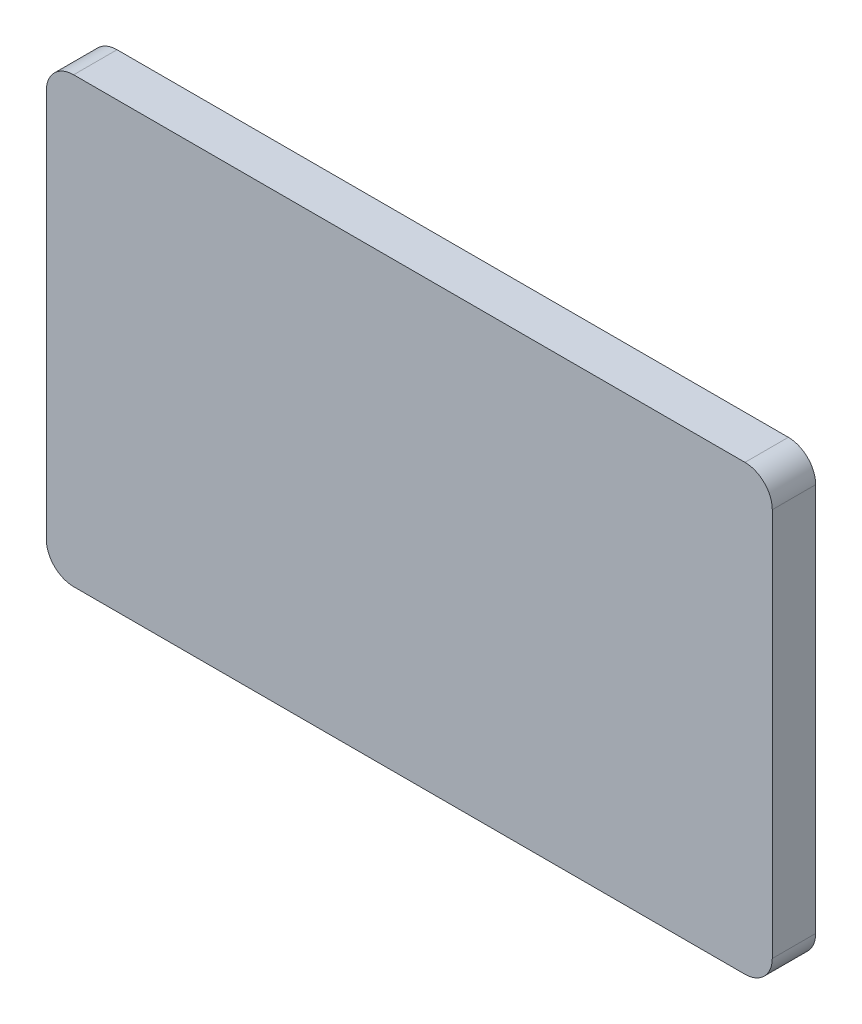
from build123d import *

# Parameters (mm, degrees)
BOSS_EXTRUDE1_START = 0.5
BOSS_EXTRUDE1_DEPTH = 1.5875


with BuildPart() as part:
    # Sketch1 → Boss-Extrude1 (new body)
    with BuildSketch(Plane.XY.offset(6.134999756).offset(BOSS_EXTRUDE1_START)):
        with BuildLine():
            Line((-3.565294436, 51.676898136), (-28.125294436, 51.676898136))
            ThreePointArc((-28.125294436, 51.676898136), (-28.832401217, 51.384004917), (-29.125294436, 50.676898136))
            Line((-29.125294436, 50.676898136), (-29.125294436, 36.456898136))
            ThreePointArc((-29.125294436, 36.456898136), (-28.832401217, 35.749791355), (-28.125294436, 35.456898136))
            Line((-28.125294436, 35.456898136), (-3.565294436, 35.456898136))
            ThreePointArc((-3.565294436, 35.456898136), (-2.858187655, 35.749791355), (-2.565294436, 36.456898136))
            Line((-2.565294436, 36.456898136), (-2.565294436, 50.676898136))
            ThreePointArc((-2.565294436, 50.676898136), (-2.858187655, 51.384004917), (-3.565294436, 51.676898136))
        make_face()
    extrude(amount=BOSS_EXTRUDE1_DEPTH)


solid = part.part
